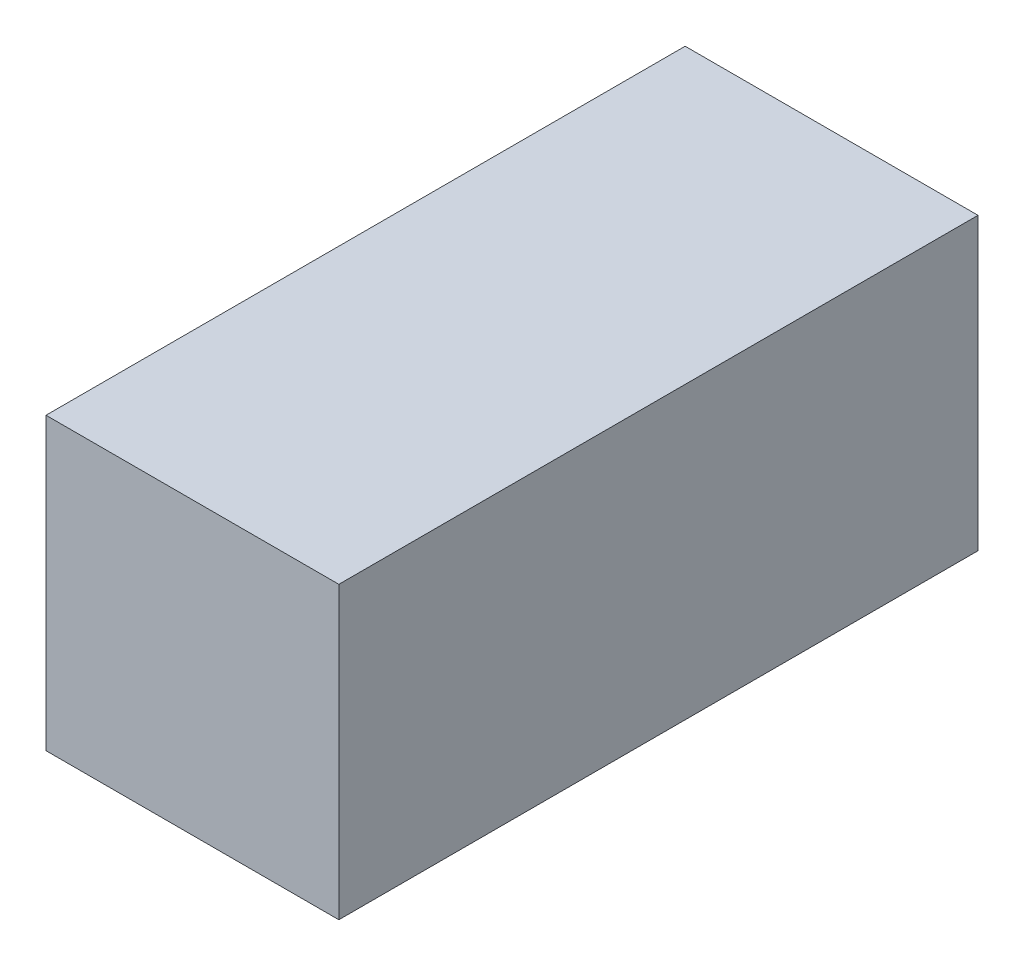
from build123d import *

# Parameters (mm, degrees)
SKETCH1_W           = 12.6
SKETCH1_H           = 27.5
BOSS_EXTRUDE1_DEPTH = 12.5


with BuildPart() as part:
    # Sketch1 → Boss-Extrude1 (new body)
    with BuildSketch(Plane.XZ.offset(-119.943926475)):
        with Locations((468.482459861, -223.845929032)):
            Rectangle(SKETCH1_W, SKETCH1_H)
    extrude(amount=BOSS_EXTRUDE1_DEPTH)


solid = part.part
